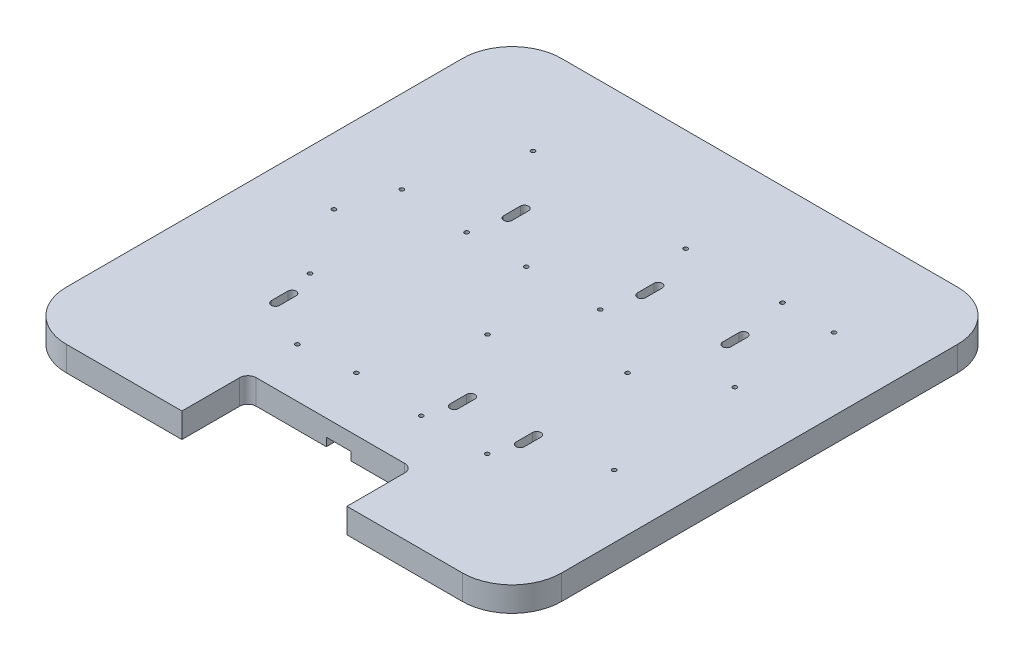
from build123d import *

# Parameters (mm, degrees)
EXTRUDE_1715_DEPTH     = 30
SKETCH_1780_R          = 2.5
CUT_EXTRUDE_1807_DEPTH = 426.323406363
CUT_EXTRUDE_2500_DEPTH = 426.323406363
CUT_EXTRUDE_START      = 10
CUT_EXTRUDE_3097_DEPTH = 10


with BuildPart() as part:
    # Sketch 1708 → Extrude 1715 (new body)
    with BuildSketch(Plane(origin=(0, 0, 0), x_dir=(1, 0, 0), z_dir=(0, 1, 0))):
        with BuildLine():
            Line((-90, -220), (90, -220))
            ThreePointArc((90, -220), (97.071067812, -222.928932188), (100, -230))
            Line((100, -230), (100, -300))
            Line((100, -300), (240, -300))
            ThreePointArc((240, -300), (282.426406871, -282.426406871), (300, -240))
            Line((300, -240), (300, 240))
            ThreePointArc((300, 240), (282.426406871, 282.426406871), (240, 300))
            Line((240, 300), (-240, 300))
            ThreePointArc((-240, 300), (-282.426406871, 282.426406871), (-300, 240))
            Line((-300, 240), (-300, -240))
            ThreePointArc((-300, -240), (-282.426406871, -282.426406871), (-240, -300))
            Line((-240, -300), (-100, -300))
            Line((-100, -300), (-100, -230))
            ThreePointArc((-100, -230), (-97.071067812, -222.928932188), (-90, -220))
        make_face()
    extrude(amount=-EXTRUDE_1715_DEPTH)

    # Sketch 1780 → Cut-Extrude 1807 (cut, through all)
    with BuildSketch(Plane(origin=(0, 0, 0), x_dir=(1, 0, 0), z_dir=(0, 1, 0))):
        with Locations(Location((-115, 60, 0), (0, 0, 270))):
            Circle(SKETCH_1780_R)
        with Locations(Location((47, 60, 0), (0, 0, 270))):
            Circle(SKETCH_1780_R)
        with Locations(Location((210, 60, 0), (0, 0, 270))):
            Circle(SKETCH_1780_R)
        with Locations(Location((-100, -160, 0), (0, 0, 270))):
            Circle(SKETCH_1780_R)
        with Locations(Location((50, -160, 0), (0, 0, 270))):
            Circle(SKETCH_1780_R)
        with Locations(Location((130, -160, 0), (0, 0, 270))):
            Circle(SKETCH_1780_R)
        with Locations(Location((-42.72, 60, 0), (0, 0, 270))):
            Circle(SKETCH_1780_R)
        with Locations(Location((-199.29, 65.75, 0), (0, 0, 270))):
            Circle(SKETCH_1780_R)
        with Locations(Location((-160.19, 185.5, 0), (0, 0, 270))):
            Circle(SKETCH_1780_R)
        with Locations(Location((34.806763, 175.55, 0), (0, 0, 270))):
            Circle(SKETCH_1780_R)
        with Locations(Location((150.216186, 177.55, 0), (0, 0, 270))):
            Circle(SKETCH_1780_R)
        with Locations(Location((212.76, 177.55, 0), (0, 0, 270))):
            Circle(SKETCH_1780_R)
        with Locations(Location((-166.666763, -78.149039, 0), (0, 0, 270))):
            Circle(SKETCH_1780_R)
        with Locations(Location((-219.52, 3.7, 0), (0, 0, 270))):
            Circle(SKETCH_1780_R)
        with Locations(Location((-34.29, -154.25, 0), (0, 0, 270))):
            Circle(SKETCH_1780_R)
        with Locations(Location((4.81, -34.5, 0), (0, 0, 270))):
            Circle(SKETCH_1780_R)
        with Locations(Location((223.895, -100, 0), (0, 0, 270))):
            Circle(SKETCH_1780_R)
        with Locations(Location((130, 10, 0), (0, 0, 270))):
            Circle(SKETCH_1780_R)
    extrude(amount=-CUT_EXTRUDE_1807_DEPTH, mode=Mode.SUBTRACT)

    # Sketch 1847 → Cut-Extrude 2500 (cut, through all)
    with BuildSketch(Plane(origin=(0, 0, 0), x_dir=(1, 0, 0), z_dir=(0, 1, 0))):
        with BuildLine():
            Line((-100, 120), (-100, 100))
            ThreePointArc((-100, 100), (-105, 95), (-110, 100))
            Line((-110, 100), (-110, 120))
            ThreePointArc((-110, 120), (-105, 125), (-100, 120))
        make_face()
        with BuildLine():
            Line((62, 120), (62, 100))
            ThreePointArc((62, 100), (57, 95), (52, 100))
            Line((52, 100), (52, 120))
            ThreePointArc((52, 120), (57, 125), (62, 120))
        make_face()
        with BuildLine():
            Line((165.216186, 120), (165.216186, 100))
            ThreePointArc((165.216186, 100), (160.216186, 95), (155.216186, 100))
            Line((155.216186, 100), (155.216186, 120))
            ThreePointArc((155.216186, 120), (160.216186, 125), (165.216186, 120))
        make_face()
        with BuildLine():
            Line((-151.666763, -110), (-151.666763, -130))
            ThreePointArc((-151.666763, -130), (-156.666763, -135), (-161.666763, -130))
            Line((-161.666763, -130), (-161.666763, -110))
            ThreePointArc((-161.666763, -110), (-156.666763, -105), (-151.666763, -110))
        make_face()
        with BuildLine():
            Line((65, -110), (65, -130))
            ThreePointArc((65, -130), (60, -135), (55, -130))
            Line((55, -130), (55, -110))
            ThreePointArc((55, -110), (60, -105), (65, -110))
        make_face()
        with BuildLine():
            Line((145, -110), (145, -130))
            ThreePointArc((145, -130), (140, -135), (135, -130))
            Line((135, -130), (135, -110))
            ThreePointArc((135, -110), (140, -105), (145, -110))
        make_face()
    extrude(amount=-CUT_EXTRUDE_2500_DEPTH, mode=Mode.SUBTRACT)

    # Sketch 2558 → Cut-Extrude 3097 (cut)
    with BuildSketch(Plane(origin=(0, -30, 0), x_dir=(1, 0, 0), z_dir=(0, 1, 0)).offset(CUT_EXTRUDE_START)):
        with BuildLine():
            Line((-105, 95), (70, 95))
            ThreePointArc((70, 95), (73.535533906, 93.535533906), (75, 90))
            Line((75, 90), (75, -100))
            ThreePointArc((75, -100), (73.535533906, -103.535533906), (70, -105))
            Line((70, -105), (-156.666763, -105))
            ThreePointArc((-156.666763, -105), (-160.202296906, -106.464466094), (-161.666763, -110))
            Line((-161.666763, -110), (-161.666763, -130))
            ThreePointArc((-161.666763, -130), (-160.202296906, -133.535533906), (-156.666763, -135))
            Line((-156.666763, -135), (-10, -135))
            ThreePointArc((-10, -135), (-6.464466094, -136.464466094), (-5, -140))
            Line((-5, -140), (-5, -220))
            Line((-5, -220), (25, -220))
            Line((25, -220), (25, -140))
            ThreePointArc((25, -140), (26.464466094, -136.464466094), (30, -135))
            Line((30, -135), (140, -135))
            ThreePointArc((140, -135), (143.535533906, -133.535533906), (145, -130))
            Line((145, -130), (145, -110))
            ThreePointArc((145, -110), (143.535533906, -106.464466094), (140, -105))
            Line((140, -105), (110, -105))
            ThreePointArc((110, -105), (106.464466094, -103.535533906), (105, -100))
            Line((105, -100), (105, 90))
            ThreePointArc((105, 90), (106.464466094, 93.535533906), (110, 95))
            Line((110, 95), (160.216186, 95))
            ThreePointArc((160.216186, 95), (163.751719906, 96.464466094), (165.216186, 100))
            Line((165.216186, 100), (165.216186, 120))
            ThreePointArc((165.216186, 120), (163.751719906, 123.535533906), (160.216186, 125))
            Line((160.216186, 125), (-105, 125))
            ThreePointArc((-105, 125), (-108.535533906, 123.535533906), (-110, 120))
            Line((-110, 120), (-110, 100))
            ThreePointArc((-110, 100), (-108.535533906, 96.464466094), (-105, 95))
        make_face()
    extrude(amount=-CUT_EXTRUDE_3097_DEPTH, mode=Mode.SUBTRACT)


solid = part.part
